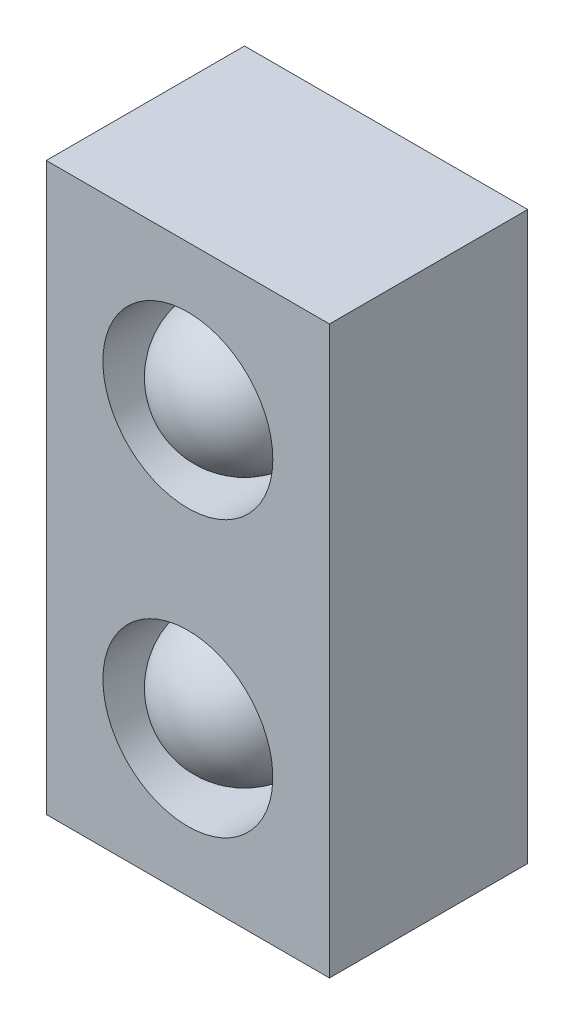
from build123d import *

# Parameters (mm, degrees)
SKETCH2_W           = 10
SKETCH2_H           = 20
SKETCH2_R           = 3
BOSS_EXTRUDE1_DEPTH = 7
SKETCH3_R           = 2.5
BOSS_EXTRUDE2_DEPTH = 5
REVOLVE1_ANGLE      = 180
LPATTERN1_COUNT     = 2
LPATTERN1_PITCH     = 9.5


with BuildPart() as part:
    # Sketch2 → Boss-Extrude1 (new body)
    with BuildSketch(Plane.XY):
        Rectangle(SKETCH2_W, SKETCH2_H)
        with Locations((0, 4.865127234)):
            Circle(SKETCH2_R, mode=Mode.SUBTRACT)
        with Locations(Location((0, -4.865127234, 0), (0, 0, 180))):
            Circle(SKETCH2_R, mode=Mode.SUBTRACT)
    extrude(amount=BOSS_EXTRUDE1_DEPTH)


with BuildPart() as body_2:
    # Sketch3 → Boss-Extrude2 (new body)
    with BuildSketch(Plane(origin=(0, 0, 0), x_dir=(-1, 0, 0), z_dir=(0, 0, -1))):
        with Locations((0, 4.865127234)):
            Circle(SKETCH3_R)
    boss_extrude2 = extrude(amount=-BOSS_EXTRUDE2_DEPTH)

    # Sketch4 → Revolve1 (revolve)
    with BuildSketch(Plane.XY.offset(5)):
        with BuildLine():
            Line((-2.5, 4.865127234), (2.5, 4.865127234))
            ThreePointArc((2.5, 4.865127234), (0, 7.365127234), (-2.5, 4.865127234))
        make_face()
    revolve1 = revolve(axis=Axis((-2.5, 4.865127234, 5), (1, 0, 0)), revolution_arc=REVOLVE1_ANGLE)


with BuildPart() as lpattern1_1:
    # LPattern1: Boss-Extrude2, Revolve1 ×2
    with Locations(*[(0, -i * LPATTERN1_PITCH, 0) for i in range(1, LPATTERN1_COUNT)]):
        add(boss_extrude2)
        add(revolve1)


solid = Compound([part.part, body_2.part, lpattern1_1.part])
